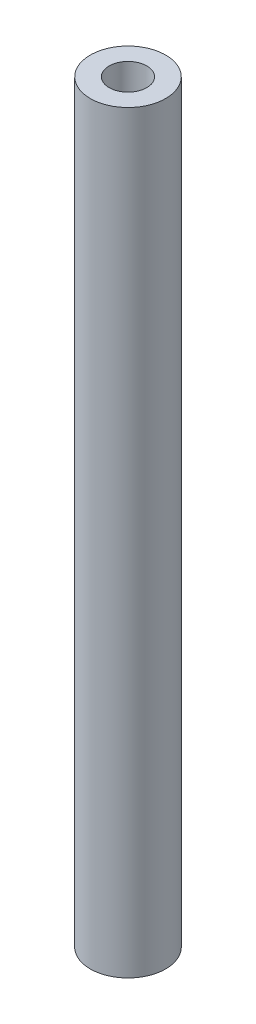
from build123d import *

# Parameters (mm, degrees)
CROQUIS_BASE_R          = 2.5
SALIENTE_EXTRUIR1_DEPTH = 50
CROQUIS_BARRENO_R       = 1.25
CORTAR_EXTRUIR1_DEPTH   = 51.124844139


with BuildPart() as part:
    # Croquis base → Saliente-Extruir1 (new body)
    with BuildSketch(Plane(origin=(0, 0, 0), x_dir=(1, 0, 0), z_dir=(0, 1, 0))):
        with Locations(Location((0, 0, 0), (0, 0, 270))):
            Circle(CROQUIS_BASE_R)
    extrude(amount=SALIENTE_EXTRUIR1_DEPTH)

    # Croquis barreno → Cortar-Extruir1 (cut, through all)
    with BuildSketch(Plane(origin=(0, 50, 0), x_dir=(1, 0, 0), z_dir=(0, 1, 0))):
        with Locations(Location((0, 0, 0), (0, 0, 270))):
            Circle(CROQUIS_BARRENO_R)
    extrude(amount=-CORTAR_EXTRUIR1_DEPTH, mode=Mode.SUBTRACT)


solid = part.part
